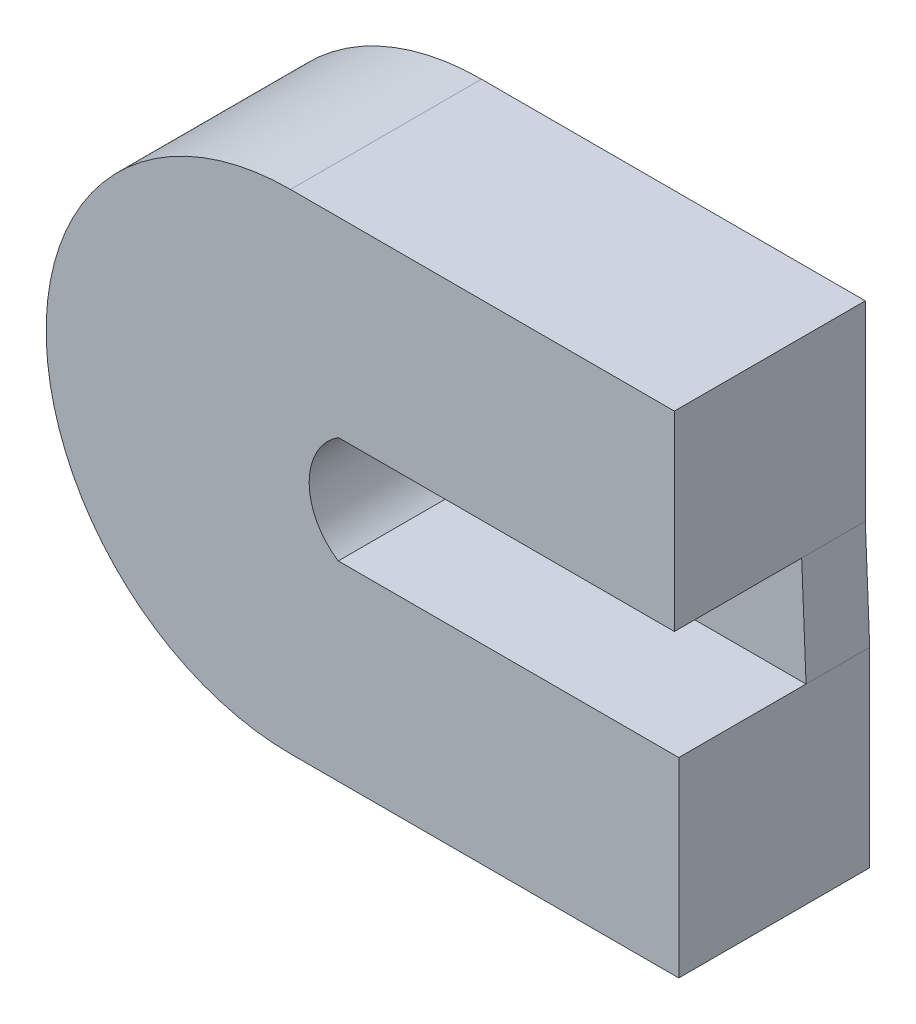
from build123d import *

# Parameters (mm, degrees)
BOSS_EXTRUDE1_DEPTH = 6
BOSS_EXTRUDE2_DEPTH = 2


with BuildPart() as part:
    # Sketch1 → Boss-Extrude1 (new body)
    with BuildSketch(Plane.XY):
        with BuildLine():
            Line((-2, 6.705426357), (2, 6.705426357))
            Line((2, 6.705426357), (8.562541674, 6.705426357))
            Line((8.562541674, 6.705426357), (8.562541674, 12.705426357))
            Line((8.562541674, 12.705426357), (3.5, 12.705426357))
            Line((3.5, 12.705426357), (-3.5, 12.705426357))
            ThreePointArc((-3.5, 12.705426357), (-11.18, 5.025426357), (-3.5, -2.654573643))
            Line((-3.5, -2.654573643), (3.5, -2.654573643))
            Line((3.5, -2.654573643), (8.700403781, -2.654573643))
            Line((8.700403781, -2.654573643), (8.700403781, 3.345426357))
            Line((8.700403781, 3.345426357), (2, 3.345426357))
            Line((2, 3.345426357), (-2, 3.345426357))
            ThreePointArc((-2, 3.345426357), (-2.914827203, 5.025426357), (-2, 6.705426357))
        make_face()
    extrude(amount=BOSS_EXTRUDE1_DEPTH)

    # Sketch2 → Boss-Extrude2 (add)
    with BuildSketch(Plane.XY):
        Polygon((8.562541674, 6.705426357), (8.700403781, 3.345426357), (2.7, 3.345426357), (2.7, 6.705426357), align=None)
    extrude(amount=BOSS_EXTRUDE2_DEPTH)


solid = part.part
